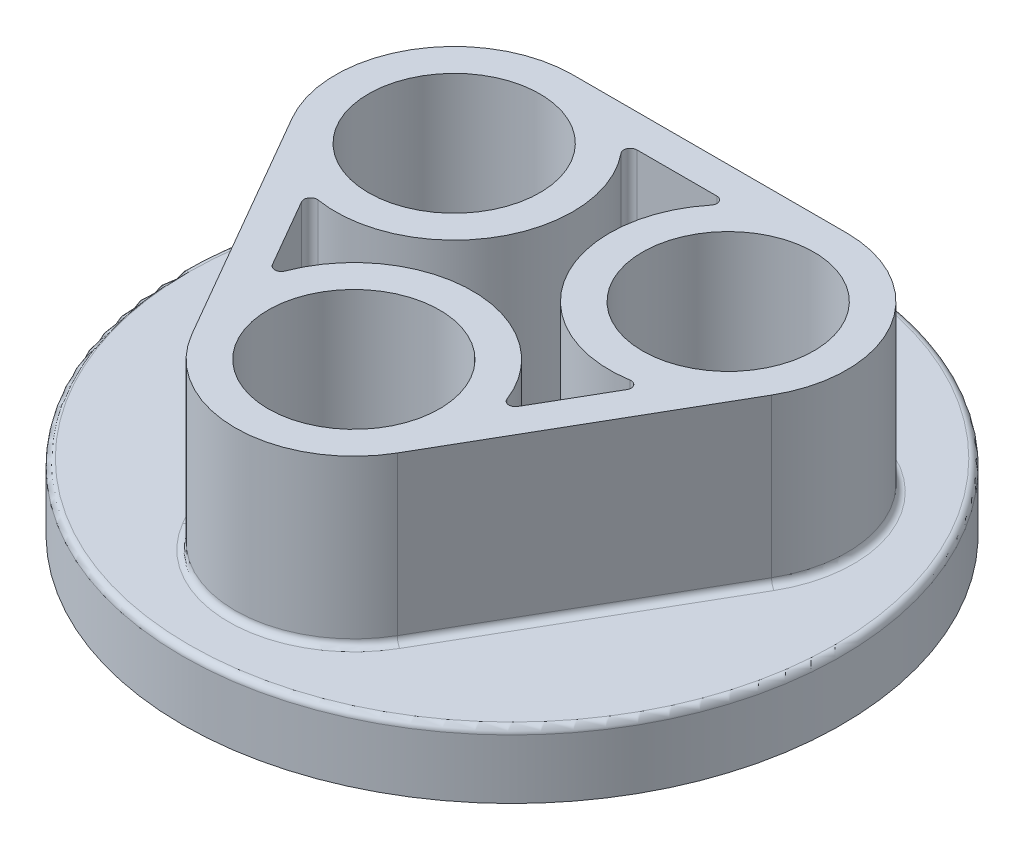
from build123d import *

# Parameters (mm, degrees)
SKETCH1_R             = 18
SKETCH1_R_2           = 13
BOSS_EXTRUDE6_DEPTH   = 10
BOSS_EXTRUDE6_2_DEPTH = 10
BOSS_EXTRUDE6_3_DEPTH = 10
SKETCH1_R_3           = 50
SKETCH1_R_4           = 45
BOSS_EXTRUDE6_4_DEPTH = 10
SKETCH1_7_R           = 45
SKETCH1_7_R_2         = 18
BOSS_EXTRUDE8_DEPTH   = 5
BOSS_EXTRUDE9_START   = 25
SKETCH1_8_R           = 13
BOSS_EXTRUDE9_DEPTH   = 25
FILLET1_R             = 1


with BuildPart() as part:
    # Sketch1 → Boss-Extrude6 (new body)
    with BuildSketch(Plane(origin=(0, 0, 0), x_dir=(1, 0, 0), z_dir=(0, 1, 0))):
        with Locations((-20.784609691, 12)):
            Circle(SKETCH1_R)
        with Locations((-20.784609691, 12)):
            Circle(SKETCH1_R_2, mode=Mode.SUBTRACT)
    extrude(amount=-BOSS_EXTRUDE6_DEPTH)



with BuildPart() as body_2:
    # Sketch1 → Boss-Extrude6 2 (new body)
    with BuildSketch(Plane(origin=(0, 0, 0), x_dir=(1, 0, 0), z_dir=(0, 1, 0))):
        with Locations((0, -24)):
            Circle(SKETCH1_R)
        with Locations((0, -24)):
            Circle(SKETCH1_R_2, mode=Mode.SUBTRACT)
    extrude(amount=-BOSS_EXTRUDE6_2_DEPTH)


with BuildPart() as body_3:
    # Sketch1 → Boss-Extrude6 3 (new body)
    with BuildSketch(Plane(origin=(0, 0, 0), x_dir=(1, 0, 0), z_dir=(0, 1, 0))):
        with Locations((20.784609691, 12)):
            Circle(SKETCH1_R)
        with Locations((20.784609691, 12)):
            Circle(SKETCH1_R_2, mode=Mode.SUBTRACT)
    extrude(amount=-BOSS_EXTRUDE6_3_DEPTH)


with BuildPart() as body_4:
    # Sketch1 → Boss-Extrude6 4 (new body)
    with BuildSketch(Plane(origin=(0, 0, 0), x_dir=(1, 0, 0), z_dir=(0, 1, 0))):
        Circle(SKETCH1_R_3)
        Circle(SKETCH1_R_4, mode=Mode.SUBTRACT)
    extrude(amount=-BOSS_EXTRUDE6_4_DEPTH)


with BuildPart() as part_1:
    add(part.part)

    add(body_2.part)  # Boss-Extrude8 merges body 2

    add(body_3.part)  # Boss-Extrude8 merges body 3

    add(body_4.part)  # Boss-Extrude8 merges body 4
    # Sketch1<7> → Boss-Extrude8 (add)
    with BuildSketch(Plane(origin=(0, 0, 0), x_dir=(1, 0, 0), z_dir=(0, 1, 0))):
        Circle(SKETCH1_7_R)
        with Locations((-20.784609691, 12)):
            Circle(SKETCH1_7_R_2, mode=Mode.SUBTRACT)
        with Locations((0, -24)):
            Circle(SKETCH1_7_R_2, mode=Mode.SUBTRACT)
        with Locations((20.784609691, 12)):
            Circle(SKETCH1_7_R_2, mode=Mode.SUBTRACT)
    extrude(amount=-BOSS_EXTRUDE8_DEPTH)

    # Sketch1<8> → Boss-Extrude9 (add)
    with BuildSketch(Plane(origin=(0, 0, 0), x_dir=(1, 0, 0), z_dir=(0, 1, 0)).offset(BOSS_EXTRUDE9_START)):
        with BuildLine():
            Line((-36.373066959, 3), (-15.588457268, -33))
            ThreePointArc((-15.588457268, -33), (0, -42), (15.588457268, -33))
            Line((15.588457268, -33), (36.373066959, 3))
            ThreePointArc((36.373066959, 3), (36.373066959, 21), (20.784609691, 30))
            Line((20.784609691, 30), (-20.784609691, 30))
            ThreePointArc((-20.784609691, 30), (-36.373066959, 21), (-36.373066959, 3))
        make_face()
        with BuildLine():
            Line((-17.483280048, -19.718070674), (-25.817990141, -5.281929326))
            ThreePointArc((-25.817990141, -5.281929326), (-5.196152423, 3), (-8.334710093, 25))
            Line((-8.334710093, 25), (8.334710093, 25))
            ThreePointArc((8.334710093, 25), (5.196152423, 3), (25.817990141, -5.281929326))
            Line((25.817990141, -5.281929326), (17.483280048, -19.718070674))
            ThreePointArc((17.483280048, -19.718070674), (0, -6), (-17.483280048, -19.718070674))
        make_face(mode=Mode.SUBTRACT)
        with Locations((-20.784609691, 12)):
            Circle(SKETCH1_8_R, mode=Mode.SUBTRACT)
        with Locations((0, -24)):
            Circle(SKETCH1_8_R, mode=Mode.SUBTRACT)
        with Locations((20.784609691, 12)):
            Circle(SKETCH1_8_R, mode=Mode.SUBTRACT)
    extrude(amount=-BOSS_EXTRUDE9_DEPTH)

    # Fillet1
    fillet1_edges = [part_1.edges().sort_by_distance(p)[0] for p in [
        (-45, -5, 0),
        (-50, 0, 0),
        (-38.784609691, -5, -12),
        (-18, -5, 24),
        (2.784609691, -5, -12),
        (-8.334710093, 12.5, -25),
        (8.334710093, 12.5, -25),
        (25.817990141, 12.5, 5.281929326),
        (17.483280048, 12.5, 19.718070674),
        (-17.483280048, 12.5, 19.718070674),
        (-25.817990141, 12.5, 5.281929326),
        (-21.650635095, 0, 12.5),
        (0, 0, 6),
        (21.650635095, 0, 12.5),
        (0, 0, -25),
        (-5.196152423, 0, -3),
        (5.196152423, 0, -3),
        (25.980762114, 0, 15),
        (-25.980762114, 0, 15),
        (0, 0, -30),
    ]]
    fillet(fillet1_edges, radius=FILLET1_R)


solid = part_1.part
